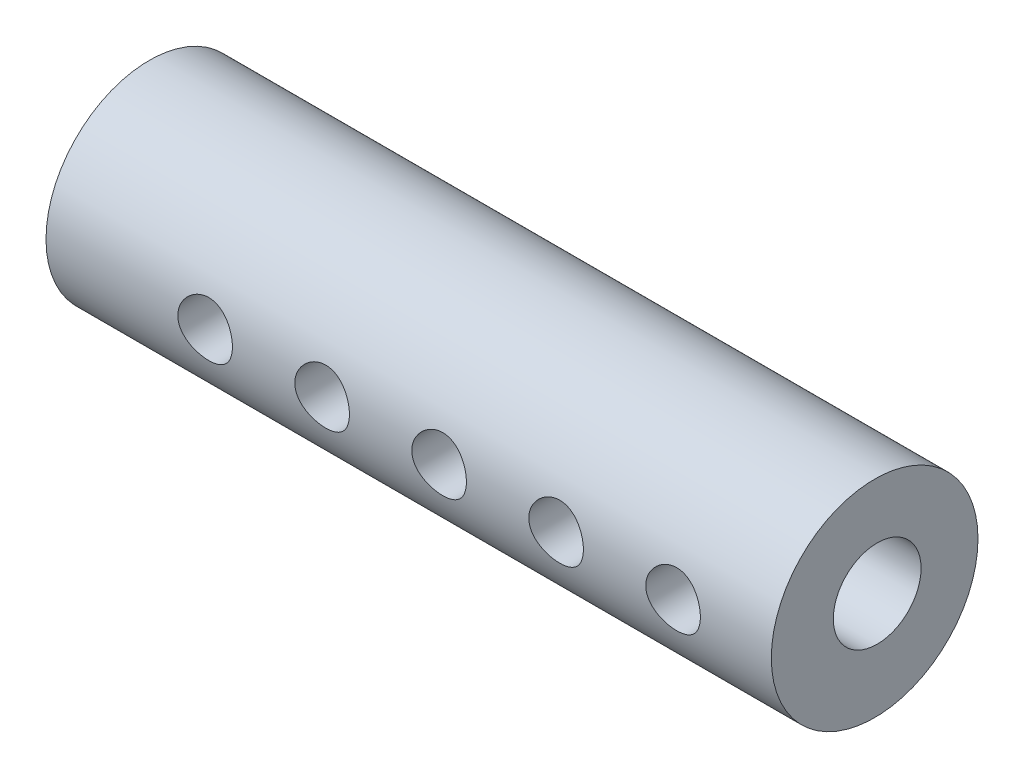
from build123d import *

# Parameters (mm, degrees)
SKETCH1_R               = 16.8275
BOSS_EXTRUDE1_DEPTH     = 118.11
SKETCH2_R               = 7.14375
CUT_EXTRUDE1_DEPTH      = 118.11
CUT_EXTRUDE2_REACH      = 125.959
CUT_EXTRUDE2_END_RADIUS = 7.14375
SKETCH4_R               = 4.445
LPATTERN1_COUNT         = 5
LPATTERN1_PITCH         = 19.05


with BuildPart() as part:
    # Sketch1 → Boss-Extrude1 (new body)
    with BuildSketch(Plane(origin=(0, 0, 0), x_dir=(0, 0, -1), z_dir=(1, 0, 0))):
        Circle(SKETCH1_R)
    extrude(amount=BOSS_EXTRUDE1_DEPTH)

    # Sketch2 → Cut-Extrude1 (cut)
    with BuildSketch(Plane.ZY):
        with Locations((-0.41275, 0.47625)):
            Circle(SKETCH2_R)
    extrude(amount=-CUT_EXTRUDE1_DEPTH, mode=Mode.SUBTRACT)

    # Cut-Extrude2: up to this cylinder (the profile starts outside it)
    cut_extrude2_end = Plane(origin=(25.908, 0.47625, -0.41275), z_dir=(-1, 0, 0)) * Cylinder(CUT_EXTRUDE2_END_RADIUS, 267.2055, mode=Mode.PRIVATE)
    # Sketch4 → Cut-Extrude2 (cut, up to the surface)
    with BuildSketch(Plane.XY.offset(16.8275), mode=Mode.PRIVATE) as cut_extrude2_sk1:
        with Locations((25.908, 0)):
            Circle(SKETCH4_R)
    cut_extrude2_tool1 = extrude(cut_extrude2_sk1.sketch, amount=-CUT_EXTRUDE2_REACH, mode=Mode.PRIVATE) - cut_extrude2_end
    cut_extrude2 = cut_extrude2_tool1.solids().sort_by_distance((25.908, 0, 16.8275))[0]
    add(cut_extrude2, mode=Mode.SUBTRACT)

    # LPattern1: Cut-Extrude2 ×5
    with Locations(*[(i * LPATTERN1_PITCH, 0, 0) for i in range(1, LPATTERN1_COUNT)]):
        add(cut_extrude2, mode=Mode.SUBTRACT)


solid = part.part
